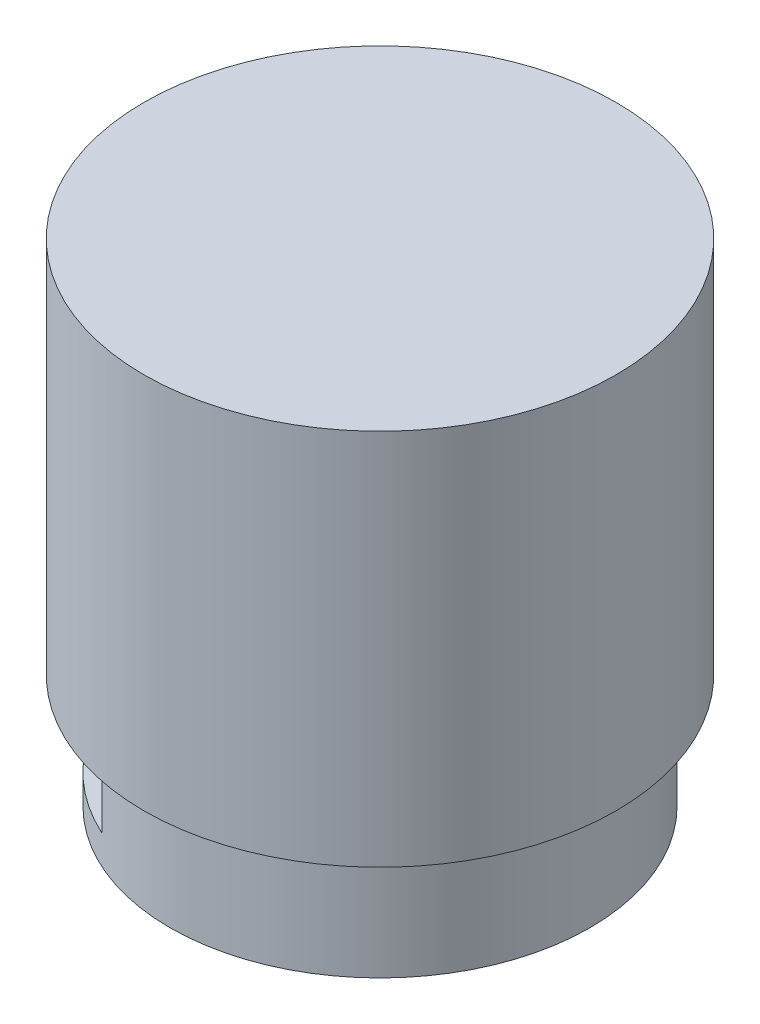
from build123d import *

# Parameters (mm, degrees)
SKETCH5_R           = 22.25
SKETCH5_R_2         = 15.275
BOSS_EXTRUDE1_DEPTH = 3.1
SKETCH6_R           = 22.25
SKETCH6_R_2         = 20.25
BOSS_EXTRUDE2_DEPTH = 6
SKETCH7_R           = 22.25
BOSS_EXTRUDE3_DEPTH = 3
SKETCH8_R           = 25
BOSS_EXTRUDE4_DEPTH = 40
SKETCH9_W           = 22.25
SKETCH9_H           = 40.5
CUT_EXTRUDE1_DEPTH  = 6


with BuildPart() as part:
    # Sketch5 → Boss-Extrude1 (new body)
    with BuildSketch(Plane(origin=(0, 0, 0), x_dir=(1, 0, 0), z_dir=(0, 1, 0))):
        with Locations(Location((0, 0, 0), (0, 0, 90))):
            Circle(SKETCH5_R)
        with Locations(Location((0, 0, 0), (0, 0, 90))):
            Circle(SKETCH5_R_2, mode=Mode.SUBTRACT)
    extrude(amount=BOSS_EXTRUDE1_DEPTH)

    # Sketch6 → Boss-Extrude2 (add)
    with BuildSketch(Plane(origin=(0, 3.1, 0), x_dir=(1, 0, 0), z_dir=(0, 1, 0))):
        with Locations(Location((0, 0, 0), (0, 0, 90))):
            Circle(SKETCH6_R)
        with Locations(Location((0, 0, 0), (0, 0, 270))):
            Circle(SKETCH6_R_2, mode=Mode.SUBTRACT)
    extrude(amount=BOSS_EXTRUDE2_DEPTH)

    # Sketch7 → Boss-Extrude3 (add)
    with BuildSketch(Plane(origin=(0, 9.1, 0), x_dir=(1, 0, 0), z_dir=(0, 1, 0))):
        with Locations(Location((0, 0, 0), (0, 0, 90))):
            Circle(SKETCH7_R)
    extrude(amount=BOSS_EXTRUDE3_DEPTH)

    # Sketch8 → Boss-Extrude4 (add)
    with BuildSketch(Plane(origin=(0, 12.1, 0), x_dir=(1, 0, 0), z_dir=(0, 1, 0))):
        with Locations(Location((0, 0, 0), (0, 0, 270))):
            Circle(SKETCH8_R)
    extrude(amount=BOSS_EXTRUDE4_DEPTH)

    # Sketch9 → Cut-Extrude1 (cut)
    with BuildSketch(Plane(origin=(0, 3.1, 0), x_dir=(1, 0, 0), z_dir=(0, 1, 0))):
        with Locations((-11.125, 0)):
            Rectangle(SKETCH9_W, SKETCH9_H)
    extrude(amount=CUT_EXTRUDE1_DEPTH, mode=Mode.SUBTRACT)


solid = part.part
